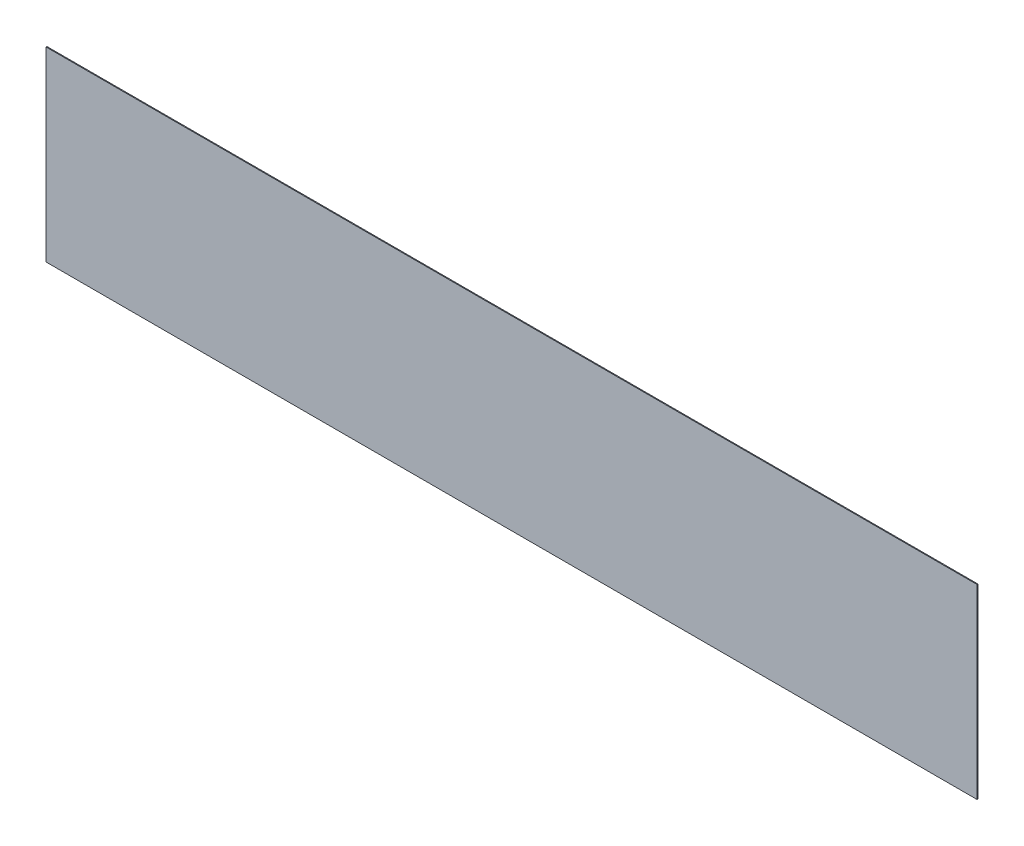
from build123d import *

# Parameters (mm, degrees)
SKETCH1_W           = 159.996
SKETCH1_H           = 32
BOSS_EXTRUDE1_DEPTH = 0.15


with BuildPart() as part:
    # Sketch1 → Boss-Extrude1 (new body)
    with BuildSketch(Plane.XY):
        with Locations((59.998, 0)):
            Rectangle(SKETCH1_W, SKETCH1_H)
    extrude(amount=BOSS_EXTRUDE1_DEPTH)


solid = part.part
